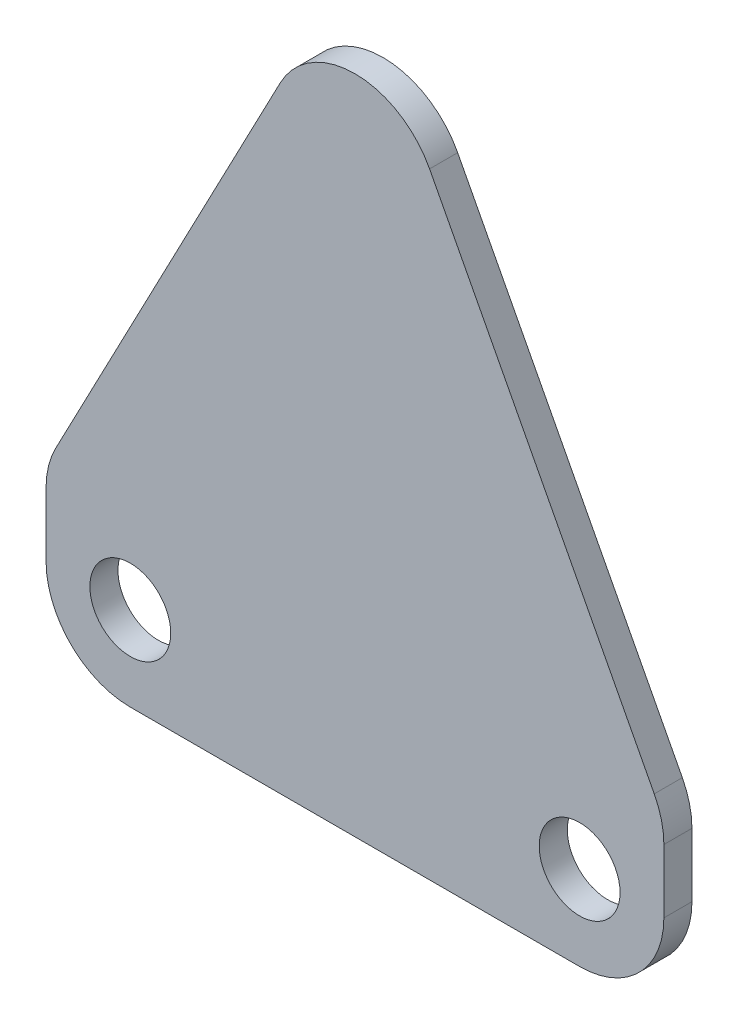
from build123d import *

# Parameters (mm, degrees)
SKETCH1_R           = 2.286
BOSS_EXTRUDE1_DEPTH = 1.5875
FILLET1_R           = 4.7625


with BuildPart() as part:
    # Sketch1 → Boss-Extrude1 (new body)
    with BuildSketch(Plane.XY):
        Polygon((-17.4625, 0), (17.4625, 0), (17.4625, 9.525), (0, 42.8625), (-17.4625, 9.525), align=None)
        with Locations((-12.7, 4.7625)):
            Circle(SKETCH1_R, mode=Mode.SUBTRACT)
        with Locations((12.7, 4.7625)):
            Circle(SKETCH1_R, mode=Mode.SUBTRACT)
    extrude(amount=BOSS_EXTRUDE1_DEPTH)

    # Fillet1
    fillet1_edges = [part.edges().sort_by_distance(p)[0] for p in [
        (-17.4625, 0, 0.79375),
        (-17.4625, 9.525, 0.79375),
        (17.4625, 0, 0.79375),
        (0, 42.8625, 0.79375),
        (17.4625, 9.525, 0.79375),
    ]]
    fillet(fillet1_edges, radius=FILLET1_R)


solid = part.part
